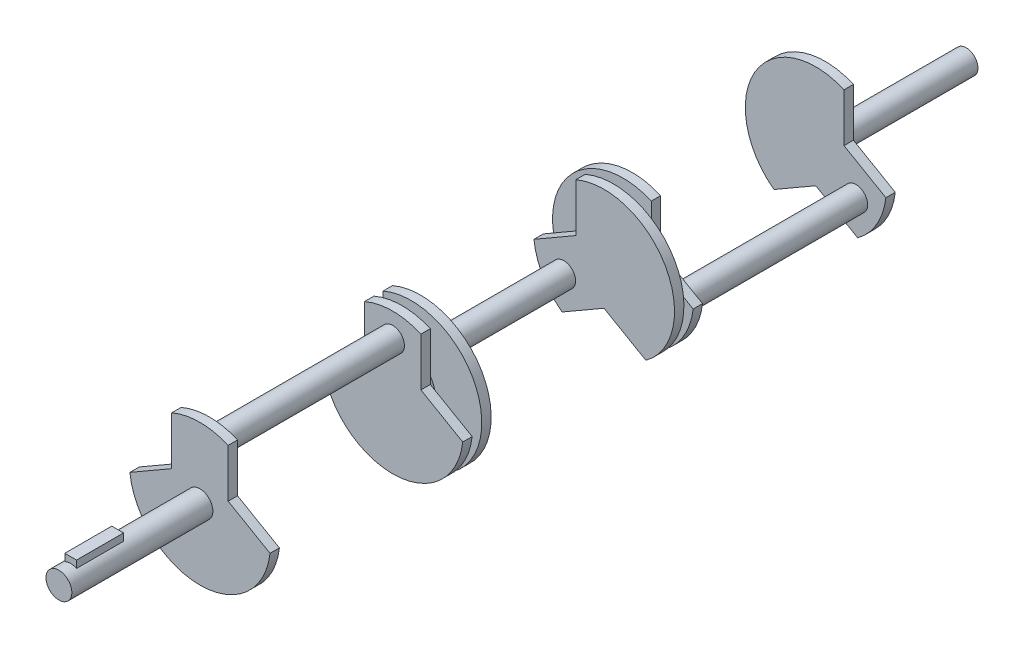
from build123d import *

# Parameters (mm, degrees)
BOSS_EXTRUDE1_DEPTH      = 5.08
LPATTERN1_COUNT          = 2
LPATTERN1_PITCH          = 104.14
BOSS_EXTRUDE2_REACH      = 119.176
SKETCH3_R                = 6.35
LPATTERN2_COUNT          = 3
LPATTERN2_PITCH          = 114.3
BODY_MOVE_COPY2_ANGLE    = 120
BODY_MOVE_COPY3_ANGLE    = 120
BOSS_EXTRUDE3_REACH      = 236.864
SKETCH5_R                = 12.7
BOSS_EXTRUDE4_START      = 114.3
SKETCH5_2_R              = 12.7
BOSS_EXTRUDE4_DEPTH      = 5.08
SKETCH6_R                = 6.985
BOSS_EXTRUDE5_DEPTH      = 76.2
SKETCH7_R                = 6.35
BOSS_EXTRUDE6_DEPTH      = 76.2
BOSS_EXTRUDE7_REACH      = 424.634
BOSS_EXTRUDE7_END_RADIUS = 6.985
BOSS_EXTRUDE7_START      = 10.16
SKETCH8_W                = 6.35
SKETCH8_H                = 25.4


with BuildPart() as part:
    # Sketch2 → Boss-Extrude1 (new body)
    with BuildSketch(Plane.XY):
        with BuildLine():
            Line((15.24, 8.798818102), (15.24, 34.919226796))
            ThreePointArc((15.24, 34.919226796), (0, 38.1), (-15.24, 34.919226796))
            Line((-15.24, 34.919226796), (-15.24, 8.798818102))
            Line((-15.24, 8.798818102), (-37.860937485, -4.261386244))
            ThreePointArc((-37.860937485, -4.261386244), (0, -38.1), (37.860937485, -4.261386244))
            Line((37.860937485, -4.261386244), (15.24, 8.798818102))
        make_face()
    extrude(amount=-BOSS_EXTRUDE1_DEPTH)


with BuildPart() as lpattern1_1:
    # LPattern1: pattern copy
    add(part.part.moved(Location(Vector(0, 0, 1) * (1 * LPATTERN1_PITCH))))

    # Sketch3 → Boss-Extrude2 (add, up to next)
    with BuildSketch(Plane.XY, mode=Mode.PRIVATE) as boss_extrude2_sk1:
        with Locations((0, 25.038762276)):
            Circle(SKETCH3_R)
    boss_extrude2_tool1 = extrude(boss_extrude2_sk1.sketch, amount=BOSS_EXTRUDE2_REACH, mode=Mode.PRIVATE) - lpattern1_1.part

    add(part.part)  # Boss-Extrude2 merges part
    add(boss_extrude2_tool1.solids().sort_by_distance((0, 25.038762, 0))[0])


with BuildPart() as lpattern2_1:
    # LPattern2: pattern copy
    add(lpattern1_1.part.moved(Location(Vector(0, 0, 1) * (1 * LPATTERN2_PITCH))))


with BuildPart() as lpattern2_2:
    # LPattern2: pattern copy
    add(lpattern1_1.part.moved(Location(Vector(0, 0, 1) * (2 * LPATTERN2_PITCH))))


with BuildPart() as lpattern2_1_1:
    # Body-Move/Copy2: moved
    add(lpattern2_1.part.rotate(Axis((0, -0.157266766, 0), (0, 0, 1)), BODY_MOVE_COPY2_ANGLE))

    # Sketch5 → Boss-Extrude3 (add, up to next)
    with BuildSketch(Plane.XY.offset(104.14), mode=Mode.PRIVATE) as boss_extrude3_sk1:
        Circle(SKETCH5_R)
    boss_extrude3_tool1 = extrude(boss_extrude3_sk1.sketch, amount=BOSS_EXTRUDE3_REACH, mode=Mode.PRIVATE) - lpattern2_1_1.part


with BuildPart() as lpattern1_1_1:
    # Body-Move/Copy3: moved
    add(lpattern1_1.part.rotate(Axis((0, 0, 0), (0, 0, -1)), BODY_MOVE_COPY3_ANGLE))


with BuildPart() as lpattern2_1_2:
    add(lpattern2_1_1.part)

    add(lpattern1_1_1.part)  # Boss-Extrude3 merges LPattern1_1
    add(boss_extrude3_tool1.solids().sort_by_distance((0, 0, 104.14))[0])


    add(lpattern2_2.part)  # Boss-Extrude4 merges LPattern2_2
    # Sketch5<2> → Boss-Extrude4 (add)
    with BuildSketch(Plane.XY.offset(104.14).offset(BOSS_EXTRUDE4_START)):
        with Locations(Location((0, 0, 0), (0, 0, 180))):
            Circle(SKETCH5_2_R)
    extrude(amount=BOSS_EXTRUDE4_DEPTH)

    # Sketch6 → Boss-Extrude5 (add)
    with BuildSketch(Plane.XY.offset(332.74)):
        with Locations(Location((0, 0, 0), (0, 0, 180))):
            Circle(SKETCH6_R)
    extrude(amount=BOSS_EXTRUDE5_DEPTH)

    # Sketch7 → Boss-Extrude6 (add)
    with BuildSketch(Plane(origin=(0, 0, -5.08), x_dir=(-1, 0, 0), z_dir=(0, 0, -1))):
        with Locations(Location((0, 0, 0), (0, 0, 180))):
            Circle(SKETCH7_R)
    extrude(amount=BOSS_EXTRUDE6_DEPTH)

    # Boss-Extrude7: up to this cylinder (the profile starts outside it)
    boss_extrude7_end = Plane(origin=(0, 0, 389.89), z_dir=(0, 0, -1)) * Cylinder(BOSS_EXTRUDE7_END_RADIUS, 864.238, mode=Mode.PRIVATE)
    # Sketch8 → Boss-Extrude7 (add, up to the surface)
    with BuildSketch(Plane(origin=(0, 0, 0), x_dir=(1, 0, 0), z_dir=(0, 1, 0)).offset(BOSS_EXTRUDE7_START), mode=Mode.PRIVATE) as boss_extrude7_sk1:
        with Locations((0, -389.89)):
            Rectangle(SKETCH8_W, SKETCH8_H)
    boss_extrude7_tool1 = extrude(boss_extrude7_sk1.sketch, amount=-BOSS_EXTRUDE7_REACH, mode=Mode.PRIVATE) - boss_extrude7_end
    add(boss_extrude7_tool1.solids().sort_by_distance((0, 10.16, 389.89))[0])


solid = lpattern2_1_2.part
